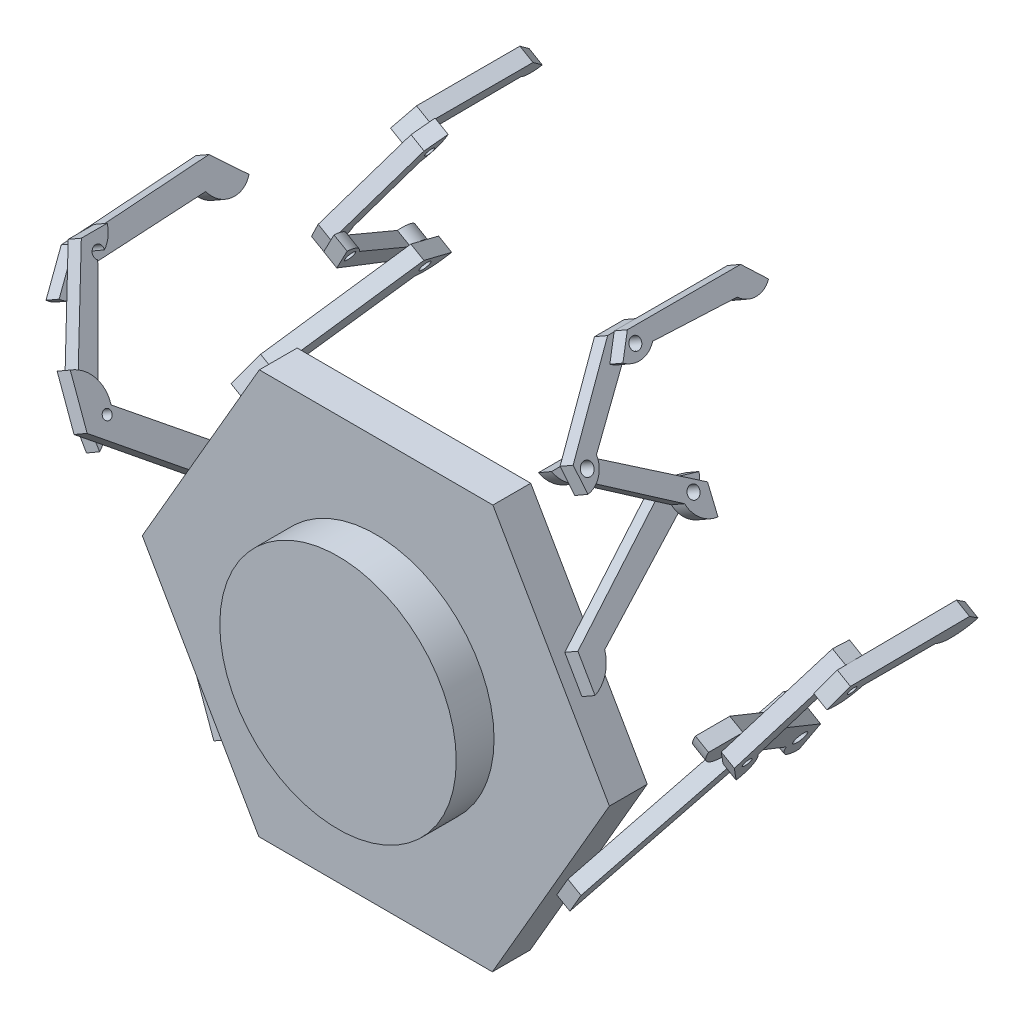
from build123d import *

# Parameters (mm, degrees)
BOSS_EXTRUDE1_DEPTH     = 5
BOSS_EXTRUDE6_DEPTH     = 2
BOSS_EXTRUDE7_DEPTH     = 2
BOSS_EXTRUDE8_DEPTH     = 2
BOSS_EXTRUDE9_DEPTH     = 2
BOSS_EXTRUDE11_DEPTH    = 2
BOSS_EXTRUDE13_DEPTH    = 2
BOSS_EXTRUDE14_DEPTH    = 2
BOSS_EXTRUDE15_DEPTH    = 2
CUT_EXTRUDE1_DEPTH      = 17
CUT_EXTRUDE1_DEPTH_BACK = 7
SKETCH14_R              = 0.843820251
SKETCH15_R              = 0.591299045
CUT_EXTRUDE2_DEPTH      = 9
SKETCH16_R              = 0.745246452
CUT_EXTRUDE3_DEPTH      = 9
SKETCH17_R              = 0.594105603
CUT_EXTRUDE4_DEPTH      = 9
SKETCH18_R              = 0.900425553
CUT_EXTRUDE5_DEPTH      = 9
SKETCH19_R              = 0.572522689
CUT_EXTRUDE6_DEPTH      = 9
SKETCH20_R              = 15.628651419
BOSS_EXTRUDE19_DEPTH    = 5
BOSS_EXTRUDE21_DEPTH    = 2
BOSS_EXTRUDE22_DEPTH    = 2
BOSS_EXTRUDE23_DEPTH    = 2
BOSS_EXTRUDE24_DEPTH    = 2
BOSS_EXTRUDE26_DEPTH    = 2
BOSS_EXTRUDE28_DEPTH    = 2
BOSS_EXTRUDE30_DEPTH    = 2
BOSS_EXTRUDE31_DEPTH    = 2
SKETCH33_R              = 0.773592703
CUT_EXTRUDE8_DEPTH      = 9
SKETCH34_R              = 0.818902108
CUT_EXTRUDE10_DEPTH     = 7
SKETCH36_R              = 0.762479032
CUT_EXTRUDE11_DEPTH     = 11
SKETCH37_R              = 0.605145702
CUT_EXTRUDE12_DEPTH     = 11
SKETCH38_R              = 0.675314004
CUT_EXTRUDE13_DEPTH     = 11
SKETCH39_R              = 0.728279583
CUT_EXTRUDE14_DEPTH     = 11


with BuildPart() as part:
    # Sketch1 → Boss-Extrude1 (new body)
    with BuildSketch(Plane.XY):
        Polygon((15.472391475, 26.716303292), (-15.400801609, 26.757635721), (-30.873193084, 0.041332429), (-15.472391475, -26.716303292), (15.400801609, -26.757635721), (30.873193084, -0.041332429), align=None)
    extrude(amount=BOSS_EXTRUDE1_DEPTH)

    # Sketch4 → Boss-Extrude6 (add)
    with BuildSketch(Plane(origin=(23.136997346, -13.399484075, 0), x_dir=(0, 0, -1), z_dir=(0.8653552380378925, -0.5011589687917225, 0))):
        with BuildLine():
            Line((-2.748486887, 0), (15.83750733, 19.866480083))
            Line((15.83750733, 19.866480083), (18.194718131, 17.952453432))
            ThreePointArc((18.194718131, 17.952453432), (16.621867117, 16.508580791), (14.699729366, 15.57905673))
            Line((14.699729366, 15.57905673), (-2.748486887, -2.931085956))
            Line((-2.748486887, -2.931085956), (-2.748486887, 0))
        make_face()
    extrude(amount=BOSS_EXTRUDE6_DEPTH)

    # Sketch6 → Boss-Extrude7 (add)
    with BuildSketch(Plane(origin=(24.867707822, -14.401802012, 0), x_dir=(0, 0, -1), z_dir=(0.8653552380378923, -0.5011589687917226, 0))):
        with BuildLine():
            Line((18.194718131, 17.952453432), (2.226468306, 29.334361597))
            Line((2.226468306, 29.334361597), (-2.324403142, 29.334361597))
            ThreePointArc((-2.324403142, 29.334361597), (-0.88281065, 26.378769621), (2.226468306, 25.308210319))
            Line((2.226468306, 25.308210319), (14.167780016, 16.926874503))
            ThreePointArc((14.167780016, 16.926874503), (15.156156266, 14.748746045), (17.395213218, 13.90746419))
            Line((17.395213218, 13.90746419), (18.194718131, 17.952453432))
        make_face()
    extrude(amount=BOSS_EXTRUDE7_DEPTH)

    # Sketch7 → Boss-Extrude8 (add)
    with BuildSketch(Plane(origin=(26.598418298, -15.40411995, 0), x_dir=(0, 0, -1), z_dir=(0.8653552380378923, -0.5011589687917227, 0))):
        with BuildLine():
            Line((0.462222432, 27.131780977), (9.006407877, 39.420011798))
            Line((9.006407877, 39.420011798), (11.397349077, 39.127292835))
            ThreePointArc((11.397349077, 39.127292835), (11.044495796, 37.772536895), (9.837033735, 37.064084731))
            Line((9.837033735, 37.064084731), (3.560829993, 27.131780977))
            ThreePointArc((3.560829993, 27.131780977), (3.971454284, 24.94193678), (2.713355824, 23.103127878))
            Line((2.713355824, 23.103127878), (0.462222432, 27.131780977))
        make_face()
    extrude(amount=BOSS_EXTRUDE8_DEPTH)

    # Sketch8 → Boss-Extrude9 (add)
    with BuildSketch(Plane(origin=(28.329128775, -16.406437887, 0), x_dir=(0, 0, -1), z_dir=(0.8653552380378924, -0.5011589687917226, 0))):
        with BuildLine():
            Line((7.960016254, 39.331916412), (23.5039716, 39.72442974))
            Line((23.5039716, 39.72442974), (25.646781585, 37.687174064))
            ThreePointArc((25.646781585, 37.687174064), (23.020213658, 36.364256943), (20.251770249, 37.356572358))
            Line((20.251770249, 37.356572358), (10.595171274, 37.356572358))
            ThreePointArc((10.595171274, 37.356572358), (8.696517007, 36.069141545), (6.407757586, 36.223887913))
            Line((6.407757586, 36.223887913), (7.960016254, 39.331916412))
        make_face()
    extrude(amount=BOSS_EXTRUDE9_DEPTH)

    # Sketch9 → Boss-Extrude11 (add)
    with BuildSketch(Plane(origin=(-23.172792279, -13.337485432, 0), x_dir=(0, 0, 1), z_dir=(-0.8666940173269905, -0.49884013504288366, 0))):
        with BuildLine():
            Line((3.48975157, 0.828906107), (-11.500447844, 16.317629387))
            Line((-11.500447844, 16.317629387), (-16.640707376, 14.79140182))
            ThreePointArc((-16.640707376, 14.79140182), (-14.521631028, 12.62118841), (-11.500447844, 12.351442265))
            Line((-11.500447844, 12.351442265), (0, -0.971864508))
            ThreePointArc((0, -0.971864508), (1.12485224, -4.351799248), (4.389808545, -5.776338381))
            Line((4.389808545, -5.776338381), (3.48975157, 0.828906107))
        make_face()
    extrude(amount=BOSS_EXTRUDE11_DEPTH)

    # Sketch10 → Boss-Extrude13 (add)
    with BuildSketch(Plane(origin=(-24.906180314, -14.335165702, 0), x_dir=(0, 0, 1), z_dir=(-0.8666940173269906, -0.4988401350428837, 0))):
        with BuildLine():
            Line((-10.858722765, 12.624063516), (5.21443354, 26.140153519))
            Line((5.21443354, 26.140153519), (4.391569787, 32.266292135))
            ThreePointArc((4.391569787, 32.266292135), (1.973828166, 30.385425649), (1.441348787, 27.368871489))
            Line((1.441348787, 27.368871489), (-11.579313317, 16.476423588))
            ThreePointArc((-11.579313317, 16.476423588), (-14.603887345, 15.529269188), (-15.870745473, 12.624063516))
            Line((-15.870745473, 12.624063516), (-10.858722765, 12.624063516))
        make_face()
    extrude(amount=BOSS_EXTRUDE13_DEPTH)

    # Sketch11 → Boss-Extrude14 (add)
    with BuildSketch(Plane(origin=(-26.639568349, -15.332845972, 0), x_dir=(0, 0, 1), z_dir=(-0.8666940173269904, -0.49884013504288377, 0))):
        with BuildLine():
            Line((3.181340463, 29.255814852), (-3.78041393, 42.245250649))
            Line((-3.78041393, 42.245250649), (-7.1980894, 42.245250649))
            ThreePointArc((-7.1980894, 42.245250649), (-6.332431245, 40.584820275), (-4.682731178, 39.698884184))
            Line((-4.682731178, 39.698884184), (1.441348787, 27.368871489))
            ThreePointArc((1.441348787, 27.368871489), (1.63630186, 25.109813544), (3.181340463, 23.450233714))
            Line((3.181340463, 23.450233714), (3.181340463, 29.255814852))
        make_face()
    extrude(amount=BOSS_EXTRUDE14_DEPTH)

    # Sketch12 → Boss-Extrude15 (add)
    with BuildSketch(Plane(origin=(-28.372956383, -16.330526242, 0), x_dir=(0, 0, 1), z_dir=(-0.8666940173269904, -0.49884013504288377, 0))):
        with BuildLine():
            Line((-4.266648438, 41.583454282), (-22.535811906, 42.545517512))
            Line((-22.535811906, 42.545517512), (-26.034231403, 38.938635571))
            ThreePointArc((-26.034231403, 38.938635571), (-23.154403068, 37.820559028), (-20.628093427, 39.598553965))
            Line((-20.628093427, 39.598553965), (-4.895788318, 38.938635571))
            ThreePointArc((-4.895788318, 38.938635571), (-2.967553842, 36.962011238), (-0.299536733, 37.673921804))
            Line((-0.299536733, 37.673921804), (-4.266648438, 41.583454282))
        make_face()
    extrude(amount=BOSS_EXTRUDE15_DEPTH)

    # Sketch14 → Cut-Extrude1 (cut, two sides: drawn at the far end of the back side and taken through both)
    with BuildSketch(Plane(origin=(-26.639568349, -15.332845972, 0), x_dir=(0, 0, 1), z_dir=(-0.8666940173269904, -0.49884013504288377, 0)).offset(-CUT_EXTRUDE1_DEPTH_BACK)):
        with Locations(Location((-12.581940677, 14.411715758, 0), (0, 0, 90))):
            Circle(SKETCH14_R)
    extrude(amount=CUT_EXTRUDE1_DEPTH + CUT_EXTRUDE1_DEPTH_BACK, mode=Mode.SUBTRACT)

    # Sketch15 → Cut-Extrude2 (cut)
    with BuildSketch(Plane(origin=(-28.372956383, -16.330526242, 0), x_dir=(0, 0, 1), z_dir=(-0.8666940173269904, -0.49884013504288377, 0))):
        with Locations(Location((2.265283406, 26.742044979, 0), (0, 0, 270))):
            Circle(SKETCH15_R)
    extrude(amount=-CUT_EXTRUDE2_DEPTH, mode=Mode.SUBTRACT)

    # Sketch16 → Cut-Extrude3 (cut)
    with BuildSketch(Plane(origin=(-30.106344418, -17.328206512, 0), x_dir=(0, 0, 1), z_dir=(-0.8666940173269904, -0.49884013504288377, 0))):
        with Locations(Location((-5.053082158, 40.269736137, 0), (0, 0, 270))):
            Circle(SKETCH16_R)
    extrude(amount=-CUT_EXTRUDE3_DEPTH, mode=Mode.SUBTRACT)

    # Sketch17 → Cut-Extrude4 (cut)
    with BuildSketch(Plane(origin=(28.329128775, -16.406437887, 0), x_dir=(0, 0, -1), z_dir=(0.8653552380378924, -0.5011589687917226, 0))):
        with Locations(Location((2.412172429, 26.627573982, 0), (0, 0, 90))):
            Circle(SKETCH17_R)
    extrude(amount=-CUT_EXTRUDE4_DEPTH, mode=Mode.SUBTRACT)

    # Sketch18 → Cut-Extrude5 (cut)
    with BuildSketch(Plane(origin=(26.598418298, -15.40411995, 0), x_dir=(0, 0, -1), z_dir=(0.8653552380378922, -0.5011589687917226, 0))):
        with Locations(Location((15.853038557, 17.255293206, 0), (0, 0, 90))):
            Circle(SKETCH18_R)
    extrude(amount=-CUT_EXTRUDE5_DEPTH, mode=Mode.SUBTRACT)

    # Sketch19 → Cut-Extrude6 (cut)
    with BuildSketch(Plane(origin=(30.059839251, -17.408755825, 0), x_dir=(0, 0, -1), z_dir=(0.8653552380378922, -0.5011589687917226, 0))):
        with Locations(Location((9.010573393, 37.700531786, 0), (0, 0, 90))):
            Circle(SKETCH19_R)
    extrude(amount=-CUT_EXTRUDE6_DEPTH, mode=Mode.SUBTRACT)

    # Sketch20 → Boss-Extrude19 (add)
    with BuildSketch(Plane.XY.offset(5)):
        Circle(SKETCH20_R)
    extrude(amount=BOSS_EXTRUDE19_DEPTH)

    # Sketch22 → Boss-Extrude21 (add)
    with BuildSketch(Plane(origin=(-23.136997346, 13.399484075, 0), x_dir=(0, 0, 1), z_dir=(-0.8653552380378925, 0.5011589687917225, 0))):
        with BuildLine():
            Line((1.670677024, 12.584579476), (-14.489214313, 19.966991801))
            Line((-14.489214313, 19.966991801), (-19.407927122, 17.466930989))
            ThreePointArc((-19.407927122, 17.466930989), (-17.251451602, 16.592488384), (-14.926070481, 16.679890806))
            Line((-14.926070481, 16.679890806), (0, 10.20762545))
            ThreePointArc((0, 10.20762545), (1.555145163, 8.815738003), (3.639572293, 8.710901551))
            Line((3.639572293, 8.710901551), (1.670677024, 12.584579476))
        make_face()
    extrude(amount=BOSS_EXTRUDE21_DEPTH)

    # Sketch23 → Boss-Extrude22 (add)
    with BuildSketch(Plane(origin=(-24.867707822, 14.401802012, 0), x_dir=(0, 0, 1), z_dir=(-0.8653552380378923, 0.5011589687917226, 0))):
        with BuildLine():
            Line((-14.423916367, 17.06255799), (-1.740178343, 25.880146144))
            Line((-1.740178343, 25.880146144), (-1.401540811, 29.27832378))
            ThreePointArc((-1.401540811, 29.27832378), (-3.089713523, 28.505347815), (-4.165872235, 26.99230407))
            Line((-4.165872235, 26.99230407), (-14.825989585, 19.204591478))
            ThreePointArc((-14.825989585, 19.204591478), (-16.875732111, 18.863144532), (-18.108611576, 17.190410641))
            Line((-18.108611576, 17.190410641), (-14.423916367, 17.06255799))
        make_face()
    extrude(amount=BOSS_EXTRUDE22_DEPTH)

    # Sketch25 → Boss-Extrude23 (add)
    with BuildSketch(Plane(origin=(-26.598418298, 15.40411995, 0), x_dir=(0, 0, 1), z_dir=(-0.8653552380378923, 0.5011589687917227, 0))):
        with BuildLine():
            Line((-1.679682849, 27.991202779), (-8.267420717, 39.324250541))
            Line((-8.267420717, 39.324250541), (-11.024944435, 40.169695012))
            ThreePointArc((-11.024944435, 40.169695012), (-10.558915921, 38.138365125), (-9.067326532, 36.682808607))
            Line((-9.067326532, 36.682808607), (-4.373778295, 28.400656456))
            ThreePointArc((-4.373778295, 28.400656456), (-3.833141035, 26.443708072), (-2.06708129, 25.442224872))
            Line((-2.06708129, 25.442224872), (-1.679682849, 27.991202779))
        make_face()
    extrude(amount=BOSS_EXTRUDE23_DEPTH)

    # Sketch26 → Boss-Extrude24 (add)
    with BuildSketch(Plane(origin=(-28.329128775, 16.406437887, 0), x_dir=(0, 0, 1), z_dir=(-0.8653552380378924, 0.5011589687917226, 0))):
        with BuildLine():
            Line((-10.448616443, 39.879253871), (-24.114472755, 39.879253871))
            Line((-24.114472755, 39.879253871), (-26.566718064, 37.427008562))
            ThreePointArc((-26.566718064, 37.427008562), (-25.104694585, 37.020923549), (-23.697710173, 37.589089505))
            Line((-23.697710173, 37.589089505), (-10.934321976, 37.325917722))
            ThreePointArc((-10.934321976, 37.325917722), (-9.487845382, 36.841215181), (-8.157912161, 37.588549588))
            Line((-8.157912161, 37.588549588), (-10.448616443, 39.879253871))
        make_face()
    extrude(amount=BOSS_EXTRUDE24_DEPTH)

    # Sketch28 → Boss-Extrude26 (add)
    with BuildSketch(Plane(origin=(23.172792279, 13.337485432, 0), x_dir=(0, 0, -1), z_dir=(0.8666940173269906, 0.4988401350428835, 0))):
        with BuildLine():
            Line((-3.393223973, -0.391890539), (13.393870741, 9.752170118))
            Line((13.393870741, 9.752170118), (17.199442052, 8.813460305))
            ThreePointArc((17.199442052, 8.813460305), (15.796101686, 6.82492099), (13.393870741, 6.43384648))
            Line((13.393870741, 6.43384648), (-0.432951543, -1.5587511))
            ThreePointArc((-0.432951543, -1.5587511), (-1.434397907, -3.666684622), (-3.393223973, -4.935258228))
            Line((-3.393223973, -4.935258228), (-3.393223973, -0.391890539))
        make_face()
    extrude(amount=BOSS_EXTRUDE26_DEPTH)

    # Sketch29 → Boss-Extrude28 (add)
    with BuildSketch(Plane(origin=(24.906180314, 14.335165702, 0), x_dir=(0, 0, -1), z_dir=(0.8666940173269906, 0.4988401350428835, 0))):
        with BuildLine():
            Line((16.223768693, 8.072069665), (3.565513437, 16.485646973))
            Line((3.565513437, 16.485646973), (-0.194485044, 16.485646973))
            ThreePointArc((-0.194485044, 16.485646973), (1.114226419, 14.751510476), (3.131960387, 13.946088402))
            Line((3.131960387, 13.946088402), (12.834541154, 7.351547378))
            ThreePointArc((12.834541154, 7.351547378), (13.917217488, 5.486371072), (15.893440274, 4.622881527))
            Line((15.893440274, 4.622881527), (16.223768693, 8.072069665))
        make_face()
    extrude(amount=BOSS_EXTRUDE28_DEPTH)

    # Sketch31 → Boss-Extrude30 (add)
    with BuildSketch(Plane(origin=(26.639568349, 15.332845972, 0), x_dir=(0, 0, -1), z_dir=(0.8666940173269906, 0.4988401350428835, 0))):
        with BuildLine():
            Line((0.943569276, 16.507578597), (10.085749854, 25.709740871))
            Line((10.085749854, 25.709740871), (14.002478389, 25.709740871))
            ThreePointArc((14.002478389, 25.709740871), (13.064446002, 24.101363214), (11.31748704, 23.457222056))
            Line((11.31748704, 23.457222056), (3.902583541, 16.261606193))
            ThreePointArc((3.902583541, 16.261606193), (3.179233024, 14.301436377), (1.320468336, 13.347237491))
            Line((1.320468336, 13.347237491), (0.943569276, 16.507578597))
        make_face()
    extrude(amount=BOSS_EXTRUDE30_DEPTH)

    # Sketch32 → Boss-Extrude31 (add)
    with BuildSketch(Plane(origin=(28.372956383, 16.330526242, 0), x_dir=(0, 0, -1), z_dir=(0.8666940173269906, 0.4988401350428835, 0))):
        with BuildLine():
            Line((10.998657073, 25.780202364), (25.969219485, 25.780202364))
            Line((25.969219485, 25.780202364), (28.378237479, 23.198090455))
            ThreePointArc((28.378237479, 23.198090455), (26.305066303, 22.328873016), (24.231895127, 23.198090455))
            Line((24.231895127, 23.198090455), (13.254692889, 23.58690619))
            ThreePointArc((13.254692889, 23.58690619), (11.265866327, 22.595461111), (9.126887058, 23.198090455))
            Line((9.126887058, 23.198090455), (10.998657073, 25.780202364))
        make_face()
    extrude(amount=BOSS_EXTRUDE31_DEPTH)

    # Sketch33 → Cut-Extrude8 (cut)
    with BuildSketch(Plane(origin=(26.639568349, 15.332845972, 0), x_dir=(0, 0, -1), z_dir=(0.8666940173269906, 0.4988401350428835, 0))):
        with Locations(Location((14.291067078, 7.888370946, 0), (0, 0, 90))):
            Circle(SKETCH33_R)
    extrude(amount=-CUT_EXTRUDE8_DEPTH, mode=Mode.SUBTRACT)

    # Sketch34 → Cut-Extrude10 (cut)
    with BuildSketch(Plane(origin=(28.372956383, 16.330526242, 0), x_dir=(0, 0, -1), z_dir=(0.8666940173269906, 0.4988401350428835, 0))):
        with Locations(Location((2.31110903, 15.527724113, 0), (0, 0, 90))):
            Circle(SKETCH34_R)
    extrude(amount=-CUT_EXTRUDE10_DEPTH, mode=Mode.SUBTRACT)

    # Sketch36 → Cut-Extrude11 (cut)
    with BuildSketch(Plane(origin=(30.106344418, 17.328206512, 0), x_dir=(0, 0, -1), z_dir=(0.8666940173269906, 0.4988401350428835, 0))):
        with Locations(Location((11.297866331, 24.249585981, 0), (0, 0, 90))):
            Circle(SKETCH36_R)
    extrude(amount=-CUT_EXTRUDE11_DEPTH, mode=Mode.SUBTRACT)

    # Sketch37 → Cut-Extrude12 (cut)
    with BuildSketch(Plane(origin=(-30.059839251, 17.408755825, 0), x_dir=(0, 0, 1), z_dir=(-0.8653552380378923, 0.5011589687917227, 0))):
        with Locations(Location((-9.66934859, 37.999854372, 0), (0, 0, 270))):
            Circle(SKETCH37_R)
    extrude(amount=-CUT_EXTRUDE12_DEPTH, mode=Mode.SUBTRACT)

    # Sketch38 → Cut-Extrude13 (cut)
    with BuildSketch(Plane(origin=(-28.329128775, 16.406437887, 0), x_dir=(0, 0, 1), z_dir=(-0.8653552380378924, 0.5011589687917226, 0))):
        with Locations(Location((-2.840097158, 27.187638847, 0), (0, 0, 270))):
            Circle(SKETCH38_R)
    extrude(amount=-CUT_EXTRUDE13_DEPTH, mode=Mode.SUBTRACT)

    # Sketch39 → Cut-Extrude14 (cut)
    with BuildSketch(Plane(origin=(-26.598418298, 15.40411995, 0), x_dir=(0, 0, 1), z_dir=(-0.8653552380378923, 0.5011589687917227, 0))):
        with Locations(Location((-15.602092839, 18.006661834, 0), (0, 0, 270))):
            Circle(SKETCH39_R)
    extrude(amount=-CUT_EXTRUDE14_DEPTH, mode=Mode.SUBTRACT)


solid = part.part
